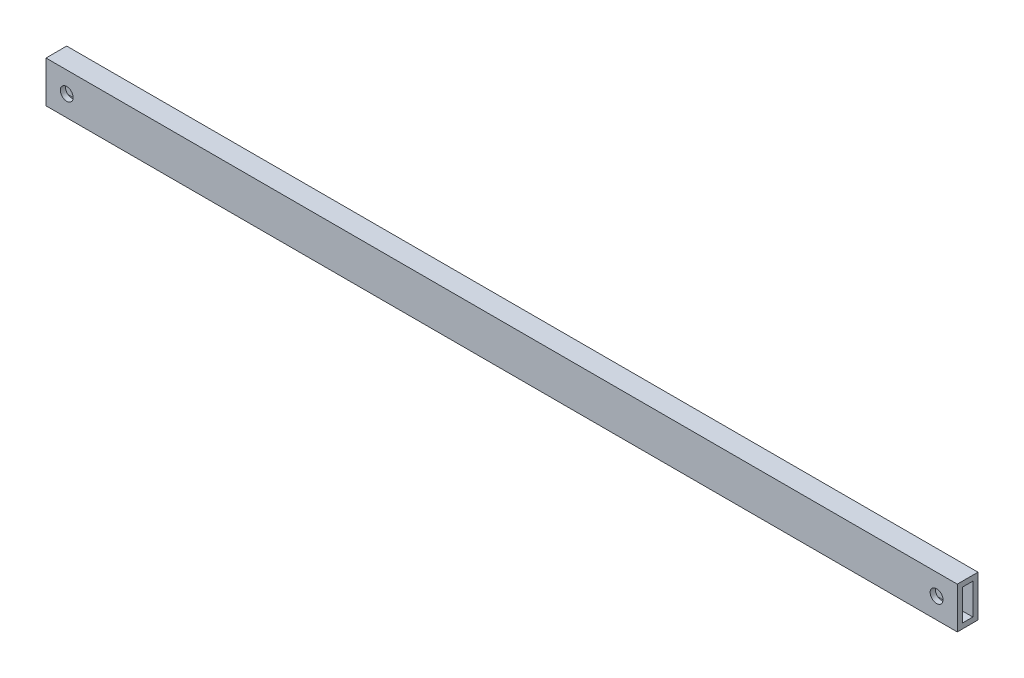
from build123d import *

# Parameters (mm, degrees)
SKETCH1_W               = 12.7
SKETCH1_H               = 25.4
SKETCH1_W_2             = 6.35
SKETCH1_H_2             = 19.05
BOSS_EXTRUDE1_DEPTH     = 558.8
CUT_EXTRUDE1_DEPTH      = 560.088561858
CUT_EXTRUDE1_DEPTH_BACK = 560.088561858
SKETCH2_R               = 3.3528
CUT_EXTRUDE2_REACH      = 561.089
SKETCH3_R               = 3.937


with BuildPart() as part:
    # Sketch1 → Boss-Extrude1 (new body)
    with BuildSketch(Plane(origin=(0, 0, 0), x_dir=(0, 0, -1), z_dir=(1, 0, 0))):
        Rectangle(SKETCH1_W, SKETCH1_H)
        Rectangle(SKETCH1_W_2, SKETCH1_H_2, mode=Mode.SUBTRACT)
    extrude(amount=BOSS_EXTRUDE1_DEPTH)

    # Sketch2 → Cut-Extrude1 (cut, two sides: drawn at the far end of the back side and taken through both)
    with BuildSketch(Plane.XY.offset(6.35).offset(-CUT_EXTRUDE1_DEPTH_BACK)):
        with Locations((546.1, 0)):
            Circle(SKETCH2_R)
        with Locations(Location((12.7, 0, 0), (0, 0, 270))):
            Circle(SKETCH2_R)
    extrude(amount=CUT_EXTRUDE1_DEPTH + CUT_EXTRUDE1_DEPTH_BACK, mode=Mode.SUBTRACT)

    # Sketch3 → Cut-Extrude2 (cut, up to next)
    with BuildSketch(Plane.XY.offset(6.35), mode=Mode.PRIVATE) as cut_extrude2_sk1:
        with Locations((546.1, 0)):
            Circle(SKETCH3_R)
    cut_extrude2_tool1 = extrude(cut_extrude2_sk1.sketch, amount=-CUT_EXTRUDE2_REACH, mode=Mode.PRIVATE) & part.part
    # Sketch3 → Cut-Extrude2 (cut, up to next)
    with BuildSketch(Plane.XY.offset(6.35), mode=Mode.PRIVATE) as cut_extrude2_sk2:
        with Locations((12.7, 0)):
            Circle(SKETCH3_R)
    cut_extrude2_tool2 = extrude(cut_extrude2_sk2.sketch, amount=-CUT_EXTRUDE2_REACH, mode=Mode.PRIVATE) & part.part
    add(cut_extrude2_tool1.solids().sort_by_distance((546.1, 0, 6.35))[0], mode=Mode.SUBTRACT)
    add(cut_extrude2_tool2.solids().sort_by_distance((12.7, 0, 6.35))[0], mode=Mode.SUBTRACT)


solid = part.part
